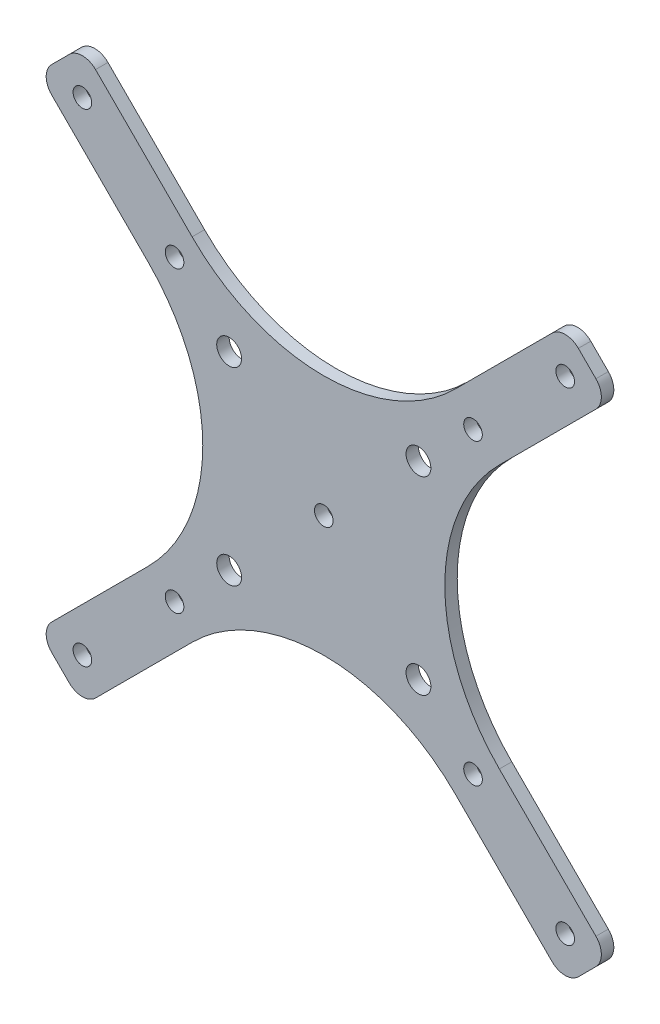
from build123d import *

# Parameters (mm, degrees)
CROQUIS1_R              = 2
CROQUIS1_R_2            = 1.5
SALIENTE_EXTRUIR1_DEPTH = 2
REDONDEO3_R             = 3


with BuildPart() as part:
    # Croquis1 → Saliente-Extruir1 (new body)
    with BuildSketch(Plane.XY):
        with BuildLine():
            Line((-31.096194078, 38.16726189), (-21.213203436, 28.284271247))
            ThreePointArc((-21.213203436, 28.284271247), (0, 19.497474683), (21.213203436, 28.284271247))
            Line((21.213203436, 28.284271247), (31.096194078, 38.16726189))
            Line((31.096194078, 38.16726189), (38.890872965, 45.961940777))
            Line((38.890872965, 45.961940777), (42.426406871, 42.426406871))
            Line((42.426406871, 42.426406871), (45.961940777, 38.890872965))
            Line((45.961940777, 38.890872965), (38.16726189, 31.096194078))
            Line((38.16726189, 31.096194078), (28.284271247, 21.213203436))
            ThreePointArc((28.284271247, 21.213203436), (19.497474683, 0), (28.284271247, -21.213203436))
            Line((28.284271247, -21.213203436), (38.16726189, -31.096194078))
            Line((38.16726189, -31.096194078), (45.961940777, -38.890872965))
            Line((45.961940777, -38.890872965), (42.426406871, -42.426406871))
            Line((42.426406871, -42.426406871), (38.890872965, -45.961940777))
            Line((38.890872965, -45.961940777), (31.096194078, -38.16726189))
            Line((31.096194078, -38.16726189), (21.213203436, -28.284271247))
            ThreePointArc((21.213203436, -28.284271247), (0, -19.497474683), (-21.213203436, -28.284271247))
            Line((-21.213203436, -28.284271247), (-31.096194078, -38.16726189))
            Line((-31.096194078, -38.16726189), (-38.890872965, -45.961940777))
            Line((-38.890872965, -45.961940777), (-42.426406871, -42.426406871))
            Line((-42.426406871, -42.426406871), (-45.961940777, -38.890872965))
            Line((-45.961940777, -38.890872965), (-38.16726189, -31.096194078))
            Line((-38.16726189, -31.096194078), (-28.284271247, -21.213203436))
            ThreePointArc((-28.284271247, -21.213203436), (-19.497474683, 0), (-28.284271247, 21.213203436))
            Line((-28.284271247, 21.213203436), (-38.16726189, 31.096194078))
            Line((-38.16726189, 31.096194078), (-45.961940777, 38.890872965))
            Line((-45.961940777, 38.890872965), (-42.426406871, 42.426406871))
            Line((-42.426406871, 42.426406871), (-38.890872965, 45.961940777))
            Line((-38.890872965, 45.961940777), (-31.096194078, 38.16726189))
        make_face()
        with Locations((-15.25, 15.25)):
            Circle(CROQUIS1_R, mode=Mode.SUBTRACT)
        with Locations((-24.04163056, 24.04163056)):
            Circle(CROQUIS1_R_2, mode=Mode.SUBTRACT)
        with Locations((-38.890872965, 38.890872965)):
            Circle(CROQUIS1_R_2, mode=Mode.SUBTRACT)
        with Locations(Location((38.890872965, 38.890872965, 0), (0, 0, 180))):
            Circle(CROQUIS1_R_2, mode=Mode.SUBTRACT)
        with Locations(Location((24.04163056, 24.04163056, 0), (0, 0, 180))):
            Circle(CROQUIS1_R_2, mode=Mode.SUBTRACT)
        with Locations(Location((15.25, 15.25, 0), (0, 0, 180))):
            Circle(CROQUIS1_R, mode=Mode.SUBTRACT)
        with Locations((15.25, -15.25)):
            Circle(CROQUIS1_R, mode=Mode.SUBTRACT)
        with Locations((24.04163056, -24.04163056)):
            Circle(CROQUIS1_R_2, mode=Mode.SUBTRACT)
        with Locations((38.890872965, -38.890872965)):
            Circle(CROQUIS1_R_2, mode=Mode.SUBTRACT)
        with Locations(Location((-15.25, -15.25, 0), (0, 0, 180))):
            Circle(CROQUIS1_R, mode=Mode.SUBTRACT)
        with Locations(Location((-24.04163056, -24.04163056, 0), (0, 0, 180))):
            Circle(CROQUIS1_R_2, mode=Mode.SUBTRACT)
        with Locations(Location((-38.890872965, -38.890872965, 0), (0, 0, 180))):
            Circle(CROQUIS1_R_2, mode=Mode.SUBTRACT)
        Circle(CROQUIS1_R_2, mode=Mode.SUBTRACT)
    extrude(amount=SALIENTE_EXTRUIR1_DEPTH)

    # Redondeo3
    redondeo3_edges = [part.edges().sort_by_distance(p)[0] for p in [
        (-38.890872965, 45.961940777, 1),
        (38.890872965, 45.961940777, 1),
        (45.961940777, 38.890872965, 1),
        (45.961940777, -38.890872965, 1),
        (38.890872965, -45.961940777, 1),
        (-38.890872965, -45.961940777, 1),
        (-45.961940777, -38.890872965, 1),
        (-45.961940777, 38.890872965, 1),
    ]]
    fillet(redondeo3_edges, radius=REDONDEO3_R)


solid = part.part
